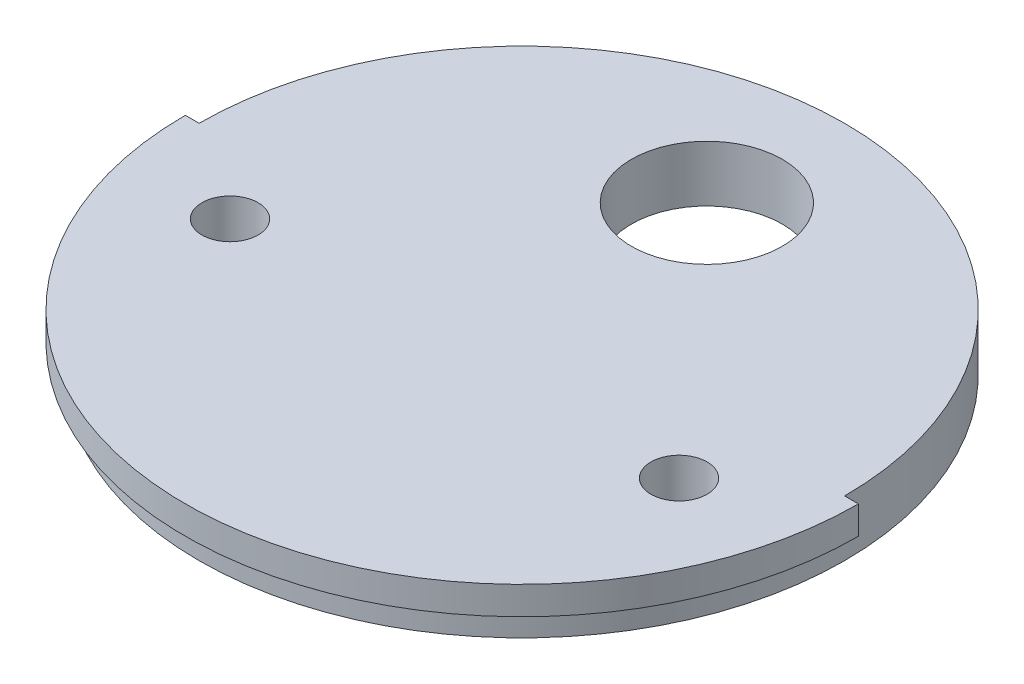
from build123d import *

# Parameters (mm, degrees)
SKETCH1_R           = 36.5125
BOSS_EXTRUDE1_DEPTH = 3.175
SKETCH2_R           = 38.0746
BOSS_EXTRUDE2_DEPTH = 3.175
SKETCH3_R           = 5.08
CUT_EXTRUDE1_DEPTH  = 55.218749804
SKETCH7_R           = 3.175
CUT_EXTRUDE4_DEPTH  = 55.218749804
SKETCH8_R           = 8.5344
CUT_EXTRUDE5_DEPTH  = 55.218749804
BOSS_EXTRUDE3_START = -6.35
SKETCH9_R           = 3.175
BOSS_EXTRUDE3_DEPTH = 6.35
SKETCH10_R          = 3.175
CUT_EXTRUDE6_DEPTH  = 55.218749804


with BuildPart() as part:
    # Sketch1 → Boss-Extrude1 (new body)
    with BuildSketch(Plane(origin=(0, 0, 0), x_dir=(1, 0, 0), z_dir=(0, 1, 0))):
        with Locations(Location((0, 0, 0), (0, 0, 270))):
            Circle(SKETCH1_R)
    extrude(amount=BOSS_EXTRUDE1_DEPTH)

    # Sketch2 → Boss-Extrude2 (add)
    with BuildSketch(Plane(origin=(0, 3.175, 0), x_dir=(1, 0, 0), z_dir=(0, 1, 0))):
        with Locations(Location((0, 0, 0), (0, 0, 270))):
            Circle(SKETCH2_R)
    extrude(amount=BOSS_EXTRUDE2_DEPTH)

    # Sketch3 → Cut-Extrude1 (cut, through all)
    with BuildSketch(Plane.XZ):
        with Locations(Location((0, -20.9296, 0), (0, 0, 270))):
            Circle(SKETCH3_R)
    extrude(amount=-CUT_EXTRUDE1_DEPTH, mode=Mode.SUBTRACT)

    # Sketch7 → Cut-Extrude4 (cut, through all)
    with BuildSketch(Plane(origin=(0, 6.35, 0), x_dir=(1, 0, 0), z_dir=(0, 1, 0))):
        with Locations(Location((-25.4, 0, 0), (0, 0, 270))):
            Circle(SKETCH7_R)
        with Locations(Location((25.4, 0, 0), (0, 0, 270))):
            Circle(SKETCH7_R)
    extrude(amount=-CUT_EXTRUDE4_DEPTH, mode=Mode.SUBTRACT)

    # Sketch8 → Cut-Extrude5 (cut, through all)
    with BuildSketch(Plane.XZ):
        with Locations(Location((0, -20.9296, 0), (0, 0, 270))):
            Circle(SKETCH8_R)
        with BuildLine():
            Line((-38.0746, 0), (-36.5125, 0))
            ThreePointArc((-36.5125, 0), (0, -36.5125), (36.5125, 0))
            Line((36.5125, 0), (38.0746, 0))
            ThreePointArc((38.0746, 0), (0, -38.0746), (-38.0746, 0))
        make_face()
    extrude(amount=-CUT_EXTRUDE5_DEPTH, mode=Mode.SUBTRACT)

    # Sketch9 → Boss-Extrude3 (add)
    with BuildSketch(Plane.XZ.offset(BOSS_EXTRUDE3_START)):
        with Locations((-25.4, 0)):
            Circle(SKETCH9_R)
        with Locations((25.4, 0)):
            Circle(SKETCH9_R)
    extrude(amount=BOSS_EXTRUDE3_DEPTH)

    # Sketch10 → Cut-Extrude6 (cut, through all)
    with BuildSketch(Plane.XZ):
        with Locations(Location((-25.4, 7.62, 0), (0, 0, 270))):
            Circle(SKETCH10_R)
        with Locations(Location((25.4, 7.62, 0), (0, 0, 270))):
            Circle(SKETCH10_R)
    extrude(amount=-CUT_EXTRUDE6_DEPTH, mode=Mode.SUBTRACT)


solid = part.part
